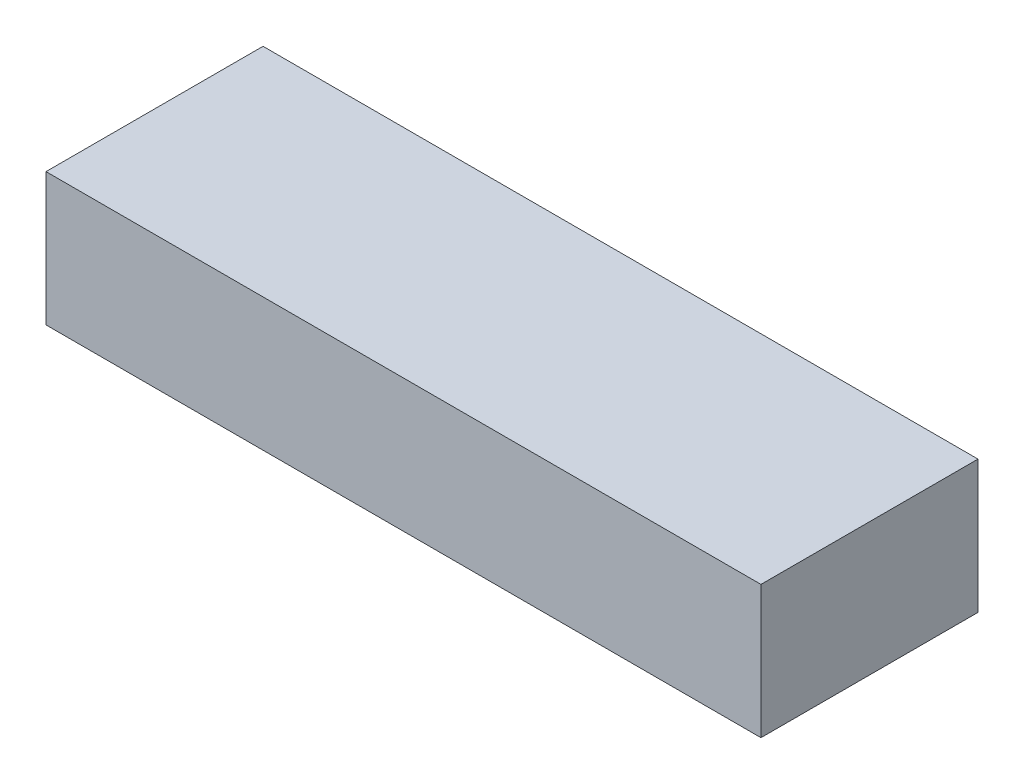
from build123d import *

# Parameters (mm, degrees)
EXTRUDE_1_DEPTH      = 13
EXTRUDE_1_DEPTH_BACK = 13
SKETCH_1_W           = 140
SKETCH_1_H           = 42.5


with BuildPart() as part:
    # 草图1 → 凸台-拉伸1 (new, two sides: drawn at the far end of the back side and taken through both)
    with BuildSketch(Plane(origin=(0, 0, 0), x_dir=(1, 0, 0), z_dir=(0, 1, 0)).offset(-EXTRUDE_1_DEPTH_BACK)):
        Rectangle(SKETCH_1_W, SKETCH_1_H)
    extrude(amount=EXTRUDE_1_DEPTH + EXTRUDE_1_DEPTH_BACK)


solid = part.part
